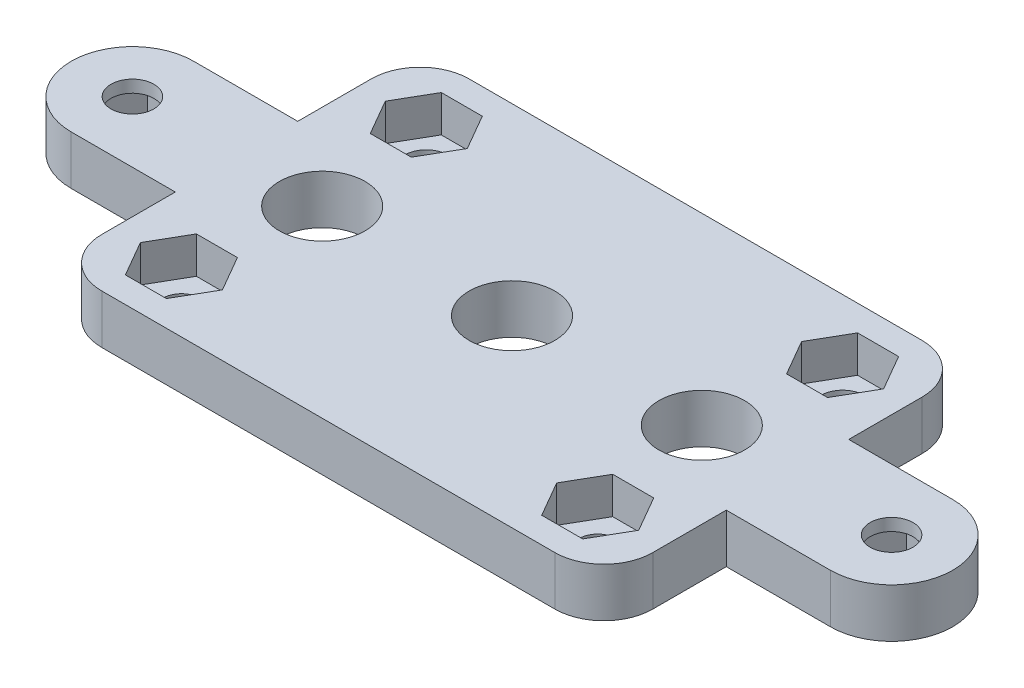
from build123d import *

# Parameters (mm, degrees)
ESBO_O2_R                = 1.75
ESBO_O2_R_2              = 1.5
ESBO_O2_R_3              = 3.5
RESSALTO_EXTRUS_O1_DEPTH = 4
CORTE_EXTRUS_O1_DEPTH    = 3
FILETE1_R                = 4
CORTE_EXTRUS_O2_DEPTH    = 3


with BuildPart() as part:
    # Esboço2 → Ressalto-extrusão1 (new body)
    with BuildSketch(Plane(origin=(0, 0, 0), x_dir=(1, 0, 0), z_dir=(0, 1, 0))):
        with BuildLine():
            Line((-22.5, -15), (22.5, -15))
            Line((22.5, -15), (22.5, -5))
            Line((22.5, -5), (31, -5))
            ThreePointArc((31, -5), (36, 0), (31, 5))
            Line((31, 5), (22.5, 5))
            Line((22.5, 5), (22.5, 15))
            Line((22.5, 15), (-22.5, 15))
            Line((-22.5, 15), (-22.5, 5))
            Line((-22.5, 5), (-31, 5))
            ThreePointArc((-31, 5), (-36, 0), (-31, -5))
            Line((-31, -5), (-22.5, -5))
            Line((-22.5, -5), (-22.5, -15))
        make_face()
        with Locations(Location((17, 10, 0), (0, 0, 270))):
            Circle(ESBO_O2_R, mode=Mode.SUBTRACT)
        with Locations(Location((17, -10, 0), (0, 0, 270))):
            Circle(ESBO_O2_R_2, mode=Mode.SUBTRACT)
        with Locations(Location((-17, -10, 0), (0, 0, 90))):
            Circle(ESBO_O2_R_2, mode=Mode.SUBTRACT)
        with Locations(Location((-17, 10, 0), (0, 0, 90))):
            Circle(ESBO_O2_R, mode=Mode.SUBTRACT)
        with Locations(Location((31, 0, 0), (0, 0, 270))):
            Circle(ESBO_O2_R, mode=Mode.SUBTRACT)
        with Locations(Location((-31, 0, 0), (0, 0, 90))):
            Circle(ESBO_O2_R, mode=Mode.SUBTRACT)
        with Locations(Location((0, 0, 0), (0, 0, 270))):
            Circle(ESBO_O2_R_3, mode=Mode.SUBTRACT)
        with Locations(Location((15.5, 0, 0), (0, 0, 270))):
            Circle(ESBO_O2_R_3, mode=Mode.SUBTRACT)
        with Locations(Location((-15.5, 0, 0), (0, 0, 90))):
            Circle(ESBO_O2_R_3, mode=Mode.SUBTRACT)
    extrude(amount=RESSALTO_EXTRUS_O1_DEPTH)

    # Esboço3 → Corte-extrusão1 (cut)
    with BuildSketch(Plane(origin=(0, 4, 0), x_dir=(1, 0, 0), z_dir=(0, 1, 0))):
        Polygon((-13.651368439, 10), (-15.325684219, 12.9), (-18.674315781, 12.9), (-20.348631561, 10), (-18.674315781, 7.1), (-15.325684219, 7.1), align=None)
        Polygon((-20.348631561, -10), (-18.674315781, -7.1), (-15.325684219, -7.1), (-13.651368439, -10), (-15.325684219, -12.9), (-18.674315781, -12.9), align=None)
        Polygon((18.674315781, -7.1), (15.325684219, -7.1), (13.651368439, -10), (15.325684219, -12.9), (18.674315781, -12.9), (20.348631561, -10), align=None)
        Polygon((15.325684219, 7.1), (13.651368439, 10), (15.325684219, 12.9), (18.674315781, 12.9), (20.348631561, 10), (18.674315781, 7.1), align=None)
    extrude(amount=-CORTE_EXTRUS_O1_DEPTH, mode=Mode.SUBTRACT)

    # Filete1
    filete1_edges = [part.edges().sort_by_distance(p)[0] for p in [
        (22.5, 2, 15),
        (-22.5, 2, 15),
        (-22.5, 2, -15),
        (22.5, 2, -15),
    ]]
    fillet(filete1_edges, radius=FILETE1_R)

    # Esboço6 → Corte-extrusão2 (cut)
    with BuildSketch(Plane.XZ):
        Polygon((-27.651368439, 0), (-29.325684219, 2.9), (-32.674315781, 2.9), (-34.348631561, 0), (-32.674315781, -2.9), (-29.325684219, -2.9), align=None)
        Polygon((29.325684219, -2.9), (27.651368439, 0), (29.325684219, 2.9), (32.674315781, 2.9), (34.348631561, 0), (32.674315781, -2.9), align=None)
    extrude(amount=-CORTE_EXTRUS_O2_DEPTH, mode=Mode.SUBTRACT)


solid = part.part
